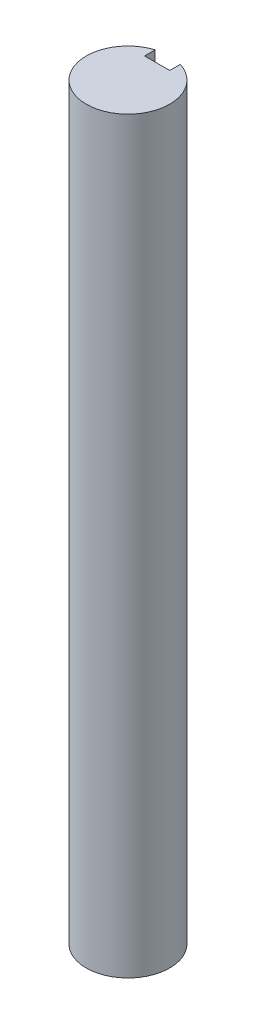
from build123d import *

# Parameters (mm, degrees)
BOSS_EXTRUDE1_DEPTH = 35.56


with BuildPart() as part:
    # Sketch1 → Boss-Extrude1 (new, symmetric)
    with BuildSketch(Plane(origin=(0, 0, 0), x_dir=(1, 0, 0), z_dir=(0, 1, 0))):
        with BuildLine():
            Line((-1.1938, 3.784946251), (-1.1938, 2.778125))
            Line((-1.1938, 2.778125), (0, 2.778125))
            Line((0, 2.778125), (1.1938, 2.778125))
            Line((1.1938, 2.778125), (1.1938, 3.784946251))
            ThreePointArc((1.1938, 3.784946251), (0, -3.96875), (-1.1938, 3.784946251))
        make_face()
    extrude(amount=BOSS_EXTRUDE1_DEPTH, both=True)


solid = part.part
